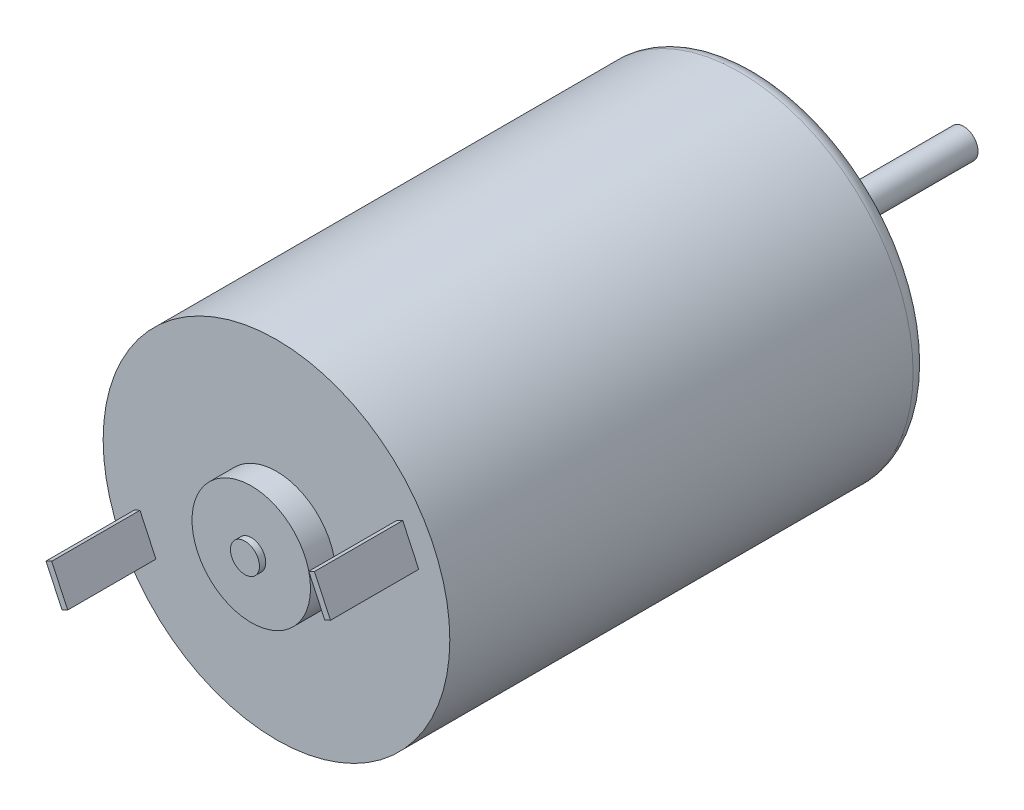
from build123d import *

# Parameters (mm, degrees)
SKIZZE2_R                            = 13.75
AUFSATZ_LINEAR_AUSTRAGEN1_DEPTH      = 38
SKIZZE3_R                            = 5
AUFSATZ_LINEAR_AUSTRAGEN2_DEPTH      = 3.5
SKIZZE4_R                            = 4.7
AUFSATZ_LINEAR_AUSTRAGEN3_DEPTH      = 2
AUFSATZ_LINEAR_AUSTRAGEN4_DEPTH      = 13
AUFSATZ_LINEAR_AUSTRAGEN4_DEPTH_BACK = 44
SKIZZE5_R                            = 1.15
SKIZZE6_R                            = 1
SCHNITT_LINEAR_AUSTRAGEN1_DEPTH      = 2
AUFSATZ_LINEAR_AUSTRAGEN5_DEPTH      = 7
AUFSATZ_LINEAR_AUSTRAGEN5_2_DEPTH    = 7
VERRUNDUNG1_R                        = 1.25


with BuildPart() as part:
    # Skizze2 → Aufsatz-Linear austragen1 (new body)
    with BuildSketch(Plane.XY):
        Circle(SKIZZE2_R)
    extrude(amount=AUFSATZ_LINEAR_AUSTRAGEN1_DEPTH)

    # Skizze3 → Aufsatz-Linear austragen2 (add)
    with BuildSketch(Plane(origin=(0, 0, 0), x_dir=(-1, 0, 0), z_dir=(0, 0, -1))):
        Circle(SKIZZE3_R)
    extrude(amount=AUFSATZ_LINEAR_AUSTRAGEN2_DEPTH)

    # Skizze4 → Aufsatz-Linear austragen3 (add)
    with BuildSketch(Plane.XY.offset(38)):
        Circle(SKIZZE4_R)
    extrude(amount=AUFSATZ_LINEAR_AUSTRAGEN3_DEPTH)

    # Skizze6 → Schnitt-Linear austragen1 (cut)
    with BuildSketch(Plane(origin=(0, 0, 0), x_dir=(-1, 0, 0), z_dir=(0, 0, -1))):
        with Locations((7.250462296, 3.380946094)):
            Circle(SKIZZE6_R)
        with Locations((-7.250462296, -3.380946094)):
            Circle(SKIZZE6_R)
    extrude(amount=-SCHNITT_LINEAR_AUSTRAGEN1_DEPTH, mode=Mode.SUBTRACT)

    # Verrundung1
    verrundung1_edges = [part.edges().sort_by_distance(p)[0] for p in [
        (-13.75, 0, 0),
    ]]
    fillet(verrundung1_edges, radius=VERRUNDUNG1_R)


with BuildPart() as body_2:
    # Skizze5 → Aufsatz-Linear austragen4 (new, two sides: drawn at the far end of the back side and taken through both)
    with BuildSketch(Plane(origin=(0, 0, -3.5), x_dir=(-1, 0, 0), z_dir=(0, 0, -1)).offset(-AUFSATZ_LINEAR_AUSTRAGEN4_DEPTH_BACK)):
        Circle(SKIZZE5_R)
    extrude(amount=AUFSATZ_LINEAR_AUSTRAGEN4_DEPTH + AUFSATZ_LINEAR_AUSTRAGEN4_DEPTH_BACK)


with BuildPart() as body_3:
    # Skizze7 → Aufsatz-Linear austragen5 (new body)
    with BuildSketch(Plane.XY.offset(38)):
        Polygon((11.28304389, 3.606302895), (10.829889997, 3.394993764), (9.562035212, 6.113917125), (10.015189105, 6.325226256), align=None)
    extrude(amount=AUFSATZ_LINEAR_AUSTRAGEN5_DEPTH)


with BuildPart() as body_4:
    # Skizze7 → Aufsatz-Linear austragen5 2 (new body)
    with BuildSketch(Plane.XY.offset(38)):
        Polygon((-10.015189105, -6.325226256), (-9.562035212, -6.113917125), (-10.829889997, -3.394993764), (-11.28304389, -3.606302895), align=None)
    extrude(amount=AUFSATZ_LINEAR_AUSTRAGEN5_2_DEPTH)


solid = Compound([part.part, body_2.part, body_3.part, body_4.part])
